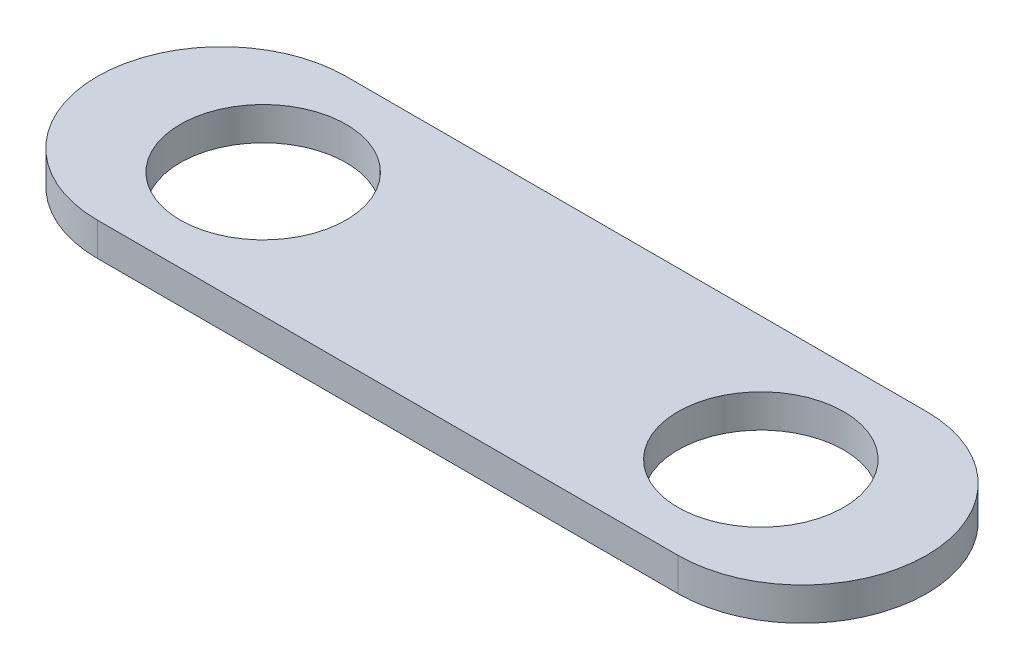
from build123d import *

# Parameters (mm, degrees)
SKETCH1_W           = 50
SKETCH1_H           = 15
BOSS_EXTRUDE1_DEPTH = 2
SKETCH2_R           = 5
CUT_EXTRUDE1_DEPTH  = 2
CUT_EXTRUDE2_DEPTH  = 2


with BuildPart() as part:
    # Sketch1 → Boss-Extrude1 (new body)
    with BuildSketch(Plane(origin=(0, 0, 0), x_dir=(1, 0, 0), z_dir=(0, 1, 0))):
        with Locations((25, 7.5)):
            Rectangle(SKETCH1_W, SKETCH1_H)
    extrude(amount=BOSS_EXTRUDE1_DEPTH)

    # Sketch2 → Cut-Extrude1 (cut)
    with BuildSketch(Plane(origin=(0, 2, 0), x_dir=(1, 0, 0), z_dir=(0, 1, 0))):
        with Locations(Location((10, 7.5, 0), (0, 0, 270))):
            Circle(SKETCH2_R)
        with Locations(Location((40, 7.5, 0), (0, 0, 90))):
            Circle(SKETCH2_R)
    extrude(amount=-CUT_EXTRUDE1_DEPTH, mode=Mode.SUBTRACT)

    # Sketch5 → Cut-Extrude2 (cut)
    with BuildSketch(Plane(origin=(0, 2, 0), x_dir=(1, 0, 0), z_dir=(0, 1, 0))):
        with BuildLine():
            ThreePointArc((0, 7.5), (2.196699141, 12.803300859), (7.5, 15))
            Line((7.5, 15), (0, 15))
            Line((0, 15), (0, 7.5))
        make_face()
        with BuildLine():
            ThreePointArc((7.5, 0), (2.196699141, 2.196699141), (0, 7.5))
            Line((0, 7.5), (0, 0))
            Line((0, 0), (7.5, 0))
        make_face()
        with BuildLine():
            Line((50, 15), (42.5, 15))
            ThreePointArc((42.5, 15), (47.803300859, 12.803300859), (50, 7.5))
            Line((50, 7.5), (50, 15))
        make_face()
        with BuildLine():
            Line((50, 0), (50, 7.5))
            ThreePointArc((50, 7.5), (47.803300859, 2.196699141), (42.5, 0))
            Line((42.5, 0), (50, 0))
        make_face()
    extrude(amount=-CUT_EXTRUDE2_DEPTH, mode=Mode.SUBTRACT)


solid = part.part
